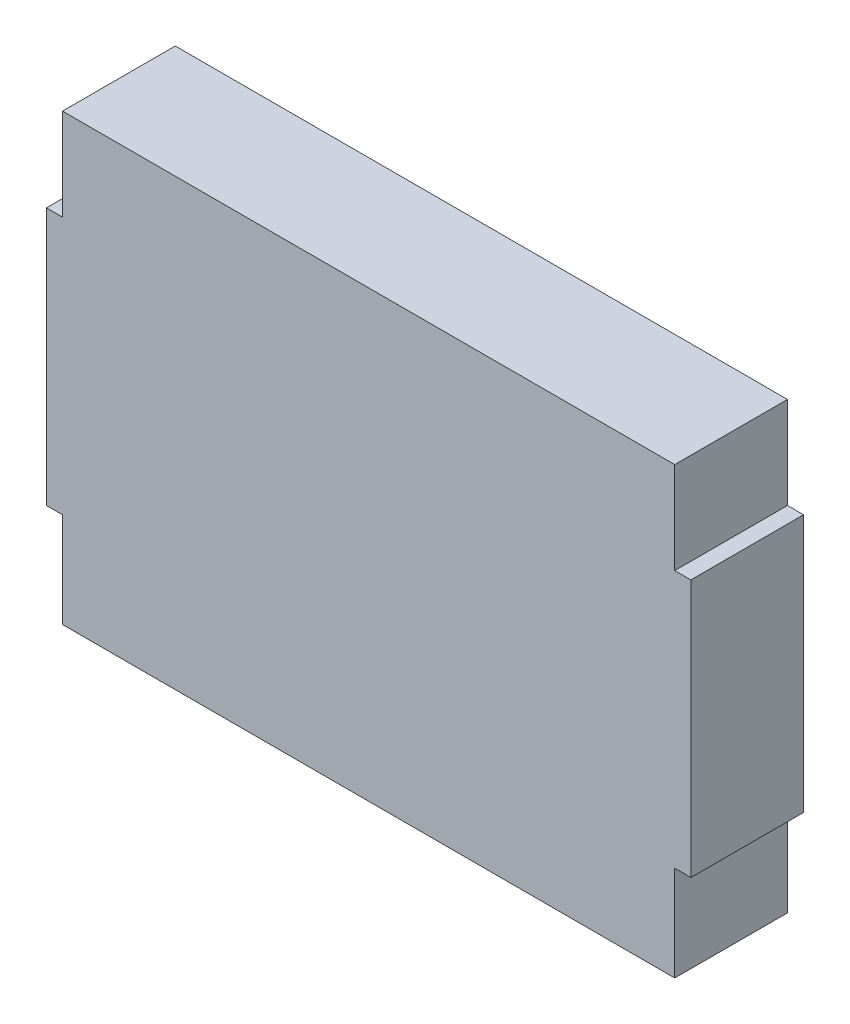
from build123d import *

# Parameters (mm, degrees)
COMPONENT_OUTLINE_DEPTH = 1.75


with BuildPart() as part:
    # 草图1 → Component_Outline (new body)
    with BuildSketch(Plane.XY):
        Polygon((-4.755, -3.456), (-4.755, -1.981), (-5.005, -1.981), (-5.005, 2.019), (-4.755, 2.019), (-4.755, 3.444), (4.745, 3.444), (4.745, 2.019), (4.995, 2.019), (4.995, -1.981), (4.745, -1.981), (4.745, -3.456), align=None)
    extrude(amount=COMPONENT_OUTLINE_DEPTH)


solid = part.part
